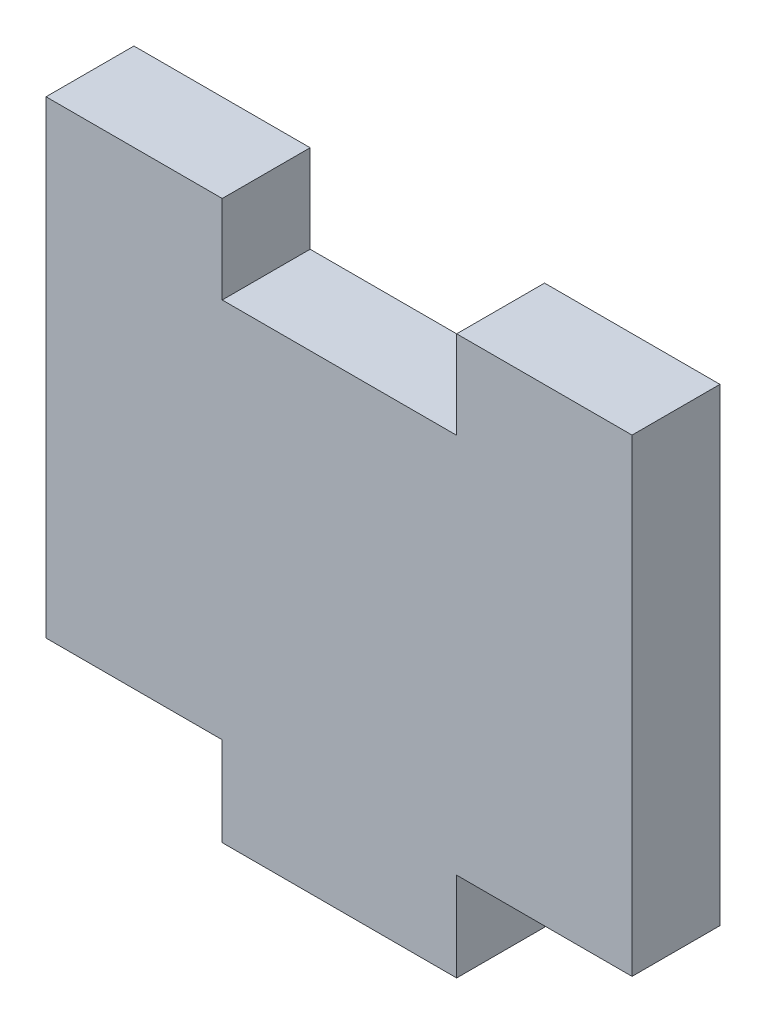
from build123d import *

# Parameters (mm, degrees)
BOSS_EXTRUDE1_DEPTH = 9.525


with BuildPart() as part:
    # Sketch1 → Boss-Extrude1 (new body)
    with BuildSketch(Plane.XY):
        Polygon((0, 0), (19.093490169, 0), (19.093490169, -9.652), (44.493490169, -9.652), (44.493490169, 0), (63.5, 0), (63.5, 12.7), (63.5, 38.1), (63.5, 50.8), (44.493490169, 50.8), (44.493490169, 41.275), (19.093490169, 41.275), (19.093490169, 50.8), (0, 50.8), align=None)
    extrude(amount=BOSS_EXTRUDE1_DEPTH)


solid = part.part
